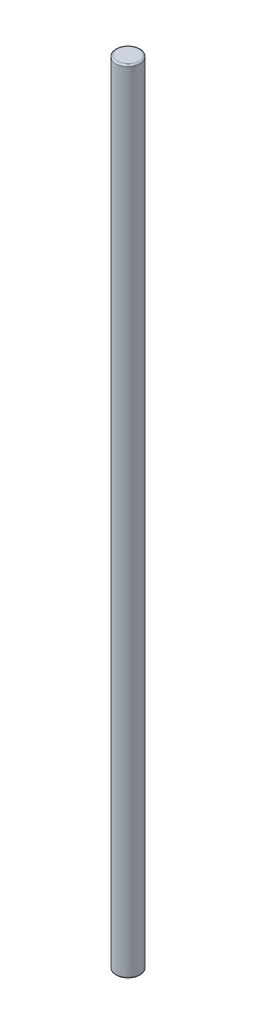
from build123d import *

# Parameters (mm, degrees)
SKETCH1_R           = 2
BOSS_EXTRUDE1_DEPTH = 130
FILLET1_R           = 0.25


with BuildPart() as part:
    # Sketch1 → Boss-Extrude1 (new body)
    with BuildSketch(Plane(origin=(0, 0, 0), x_dir=(1, 0, 0), z_dir=(0, 1, 0))):
        with Locations(Location((0, 0, 0), (0, 0, 270))):
            Circle(SKETCH1_R)
    extrude(amount=BOSS_EXTRUDE1_DEPTH)

    # Fillet1
    fillet1_edges = [part.edges().sort_by_distance(p)[0] for p in [
        (0, 0, -2),
        (0, 130, -2),
    ]]
    fillet(fillet1_edges, radius=FILLET1_R)


solid = part.part
